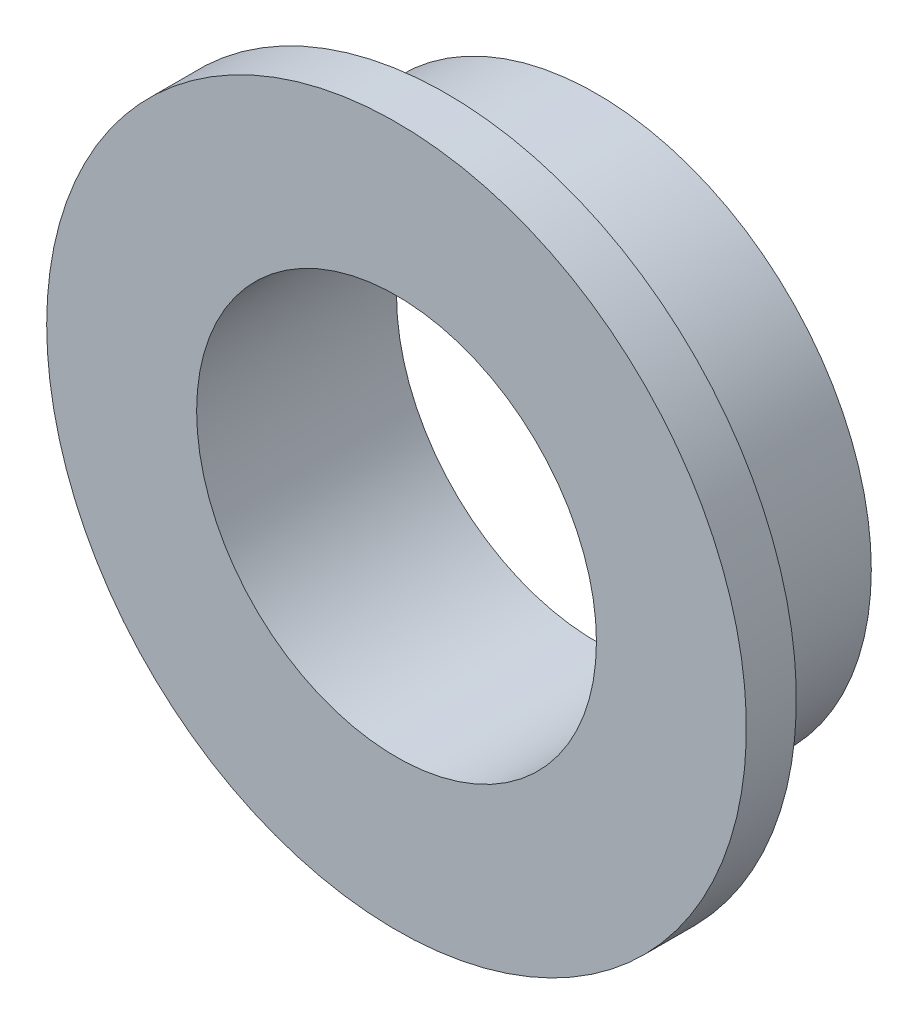
from build123d import *


with BuildPart() as part:
    # Sketch1 → Revolve1 (revolve)
    with BuildSketch(Plane(origin=(0, 0, 0), x_dir=(0, 0, -1), z_dir=(1, 0, 0)), mode=Mode.PRIVATE) as revolve1_sk:
        Polygon((0, 4), (-4, 4), (-4, 7), (-3, 7), (-3, 5.5), (0, 5.5), align=None)
    revolve(revolve1_sk.sketch.rotate(Axis((0, 0, 0), (0, 0, 1)), 90), axis=Axis((0, 0, 0), (0, 0, 1)))


solid = part.part
